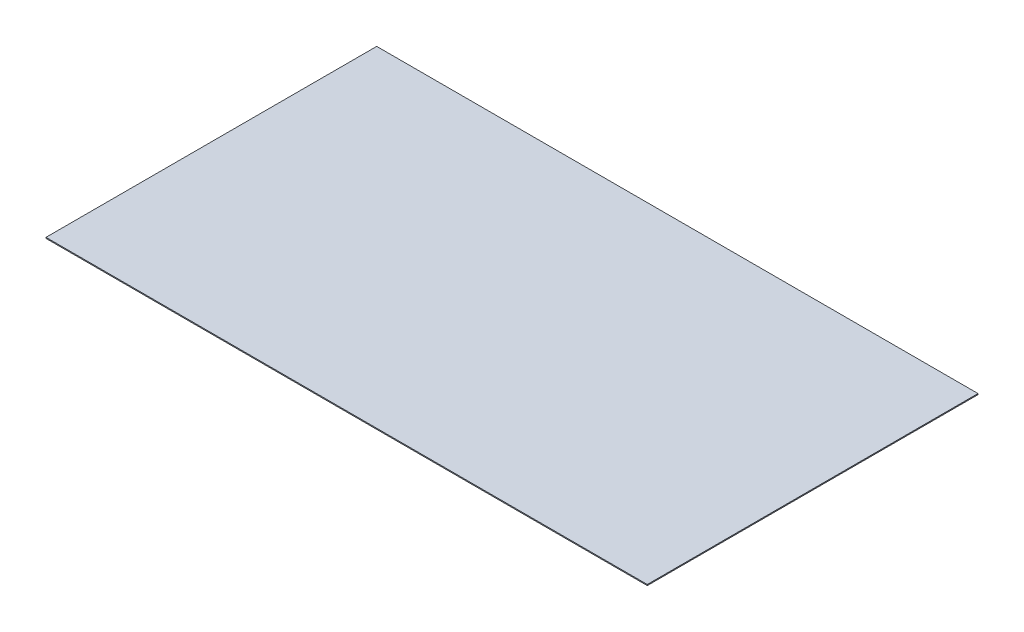
from build123d import *

# Parameters (mm, degrees)
SKETCH1_W           = 76.2
SKETCH1_H           = 41.91
BOSS_EXTRUDE1_DEPTH = 0.127


with BuildPart() as part:
    # Sketch1 → Boss-Extrude1 (new body)
    with BuildSketch(Plane(origin=(0, 0, 0), x_dir=(1, 0, 0), z_dir=(0, 1, 0))):
        Rectangle(SKETCH1_W, SKETCH1_H)
    extrude(amount=BOSS_EXTRUDE1_DEPTH)


solid = part.part
